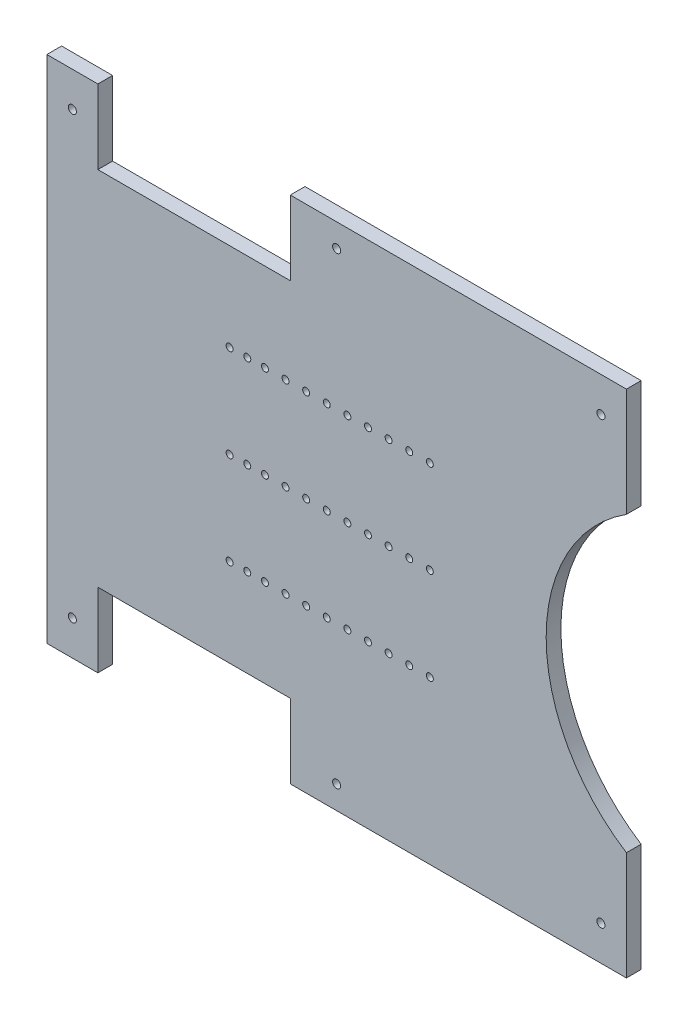
from build123d import *

# Parameters (mm, degrees)
SKETCH1_R           = 1.7525
SKETCH1_R_2         = 1.5
BOSS_EXTRUDE1_DEPTH = 6.35


with BuildPart() as part:
    # Sketch1 → Boss-Extrude1 (new body)
    with BuildSketch(Plane.XY):
        with BuildLine():
            Line((119.609790965, 110), (97.609790965, 110))
            Line((97.609790965, 110), (14.609790965, 110))
            Line((14.609790965, 110), (-25.390209035, 110))
            Line((-25.390209035, 110), (-25.390209035, 78))
            Line((-25.390209035, 78), (-108.390209035, 78))
            Line((-108.390209035, 78), (-108.390209035, 110))
            Line((-108.390209035, 110), (-130.390209035, 110))
            Line((-130.390209035, 110), (-130.390209035, -110))
            Line((-130.390209035, -110), (-108.390209035, -110))
            Line((-108.390209035, -110), (-108.390209035, -78))
            Line((-108.390209035, -78), (-25.390209035, -78))
            Line((-25.390209035, -78), (-25.390209035, -110))
            Line((-25.390209035, -110), (14.609790965, -110))
            Line((14.609790965, -110), (97.609790965, -110))
            Line((97.609790965, -110), (119.609790965, -110))
            Line((119.609790965, -110), (119.609790965, -63.2))
            ThreePointArc((119.609790965, -63.2), (84.992460515, 0), (119.609790965, 63.2))
            Line((119.609790965, 63.2), (119.609790965, 110))
        make_face()
        with Locations((-119.390209035, 95)):
            Circle(SKETCH1_R, mode=Mode.SUBTRACT)
        with Locations(Location((108.609790965, 95, 0), (0, 0, 180))):
            Circle(SKETCH1_R, mode=Mode.SUBTRACT)
        with Locations((-5.390209035, 100)):
            Circle(SKETCH1_R, mode=Mode.SUBTRACT)
        with Locations(Location((-5.390209035, -100, 0), (0, 0, 180))):
            Circle(SKETCH1_R, mode=Mode.SUBTRACT)
        with Locations((108.609790965, -95)):
            Circle(SKETCH1_R, mode=Mode.SUBTRACT)
        with Locations(Location((-119.390209035, -95, 0), (0, 0, 180))):
            Circle(SKETCH1_R, mode=Mode.SUBTRACT)
        with Locations((-36.311771099, 40)):
            Circle(SKETCH1_R_2, mode=Mode.SUBTRACT)
        with Locations((-36.311771099, 0)):
            Circle(SKETCH1_R_2, mode=Mode.SUBTRACT)
        with Locations(Location((-36.311771099, -40, 0), (0, 0, 180))):
            Circle(SKETCH1_R_2, mode=Mode.SUBTRACT)
        with Locations(Location((-27.421771099, -40, 0), (0, 0, 180))):
            Circle(SKETCH1_R_2, mode=Mode.SUBTRACT)
        with Locations((-27.421771099, 0)):
            Circle(SKETCH1_R_2, mode=Mode.SUBTRACT)
        with Locations((-27.421771099, 40)):
            Circle(SKETCH1_R_2, mode=Mode.SUBTRACT)
        with Locations(Location((-18.531771099, -40, 0), (0, 0, 180))):
            Circle(SKETCH1_R_2, mode=Mode.SUBTRACT)
        with Locations((-18.531771099, 0)):
            Circle(SKETCH1_R_2, mode=Mode.SUBTRACT)
        with Locations((-18.531771099, 40)):
            Circle(SKETCH1_R_2, mode=Mode.SUBTRACT)
        with Locations(Location((-9.641771099, -40, 0), (0, 0, 180))):
            Circle(SKETCH1_R_2, mode=Mode.SUBTRACT)
        with Locations((-9.641771099, 0)):
            Circle(SKETCH1_R_2, mode=Mode.SUBTRACT)
        with Locations((-9.641771099, 40)):
            Circle(SKETCH1_R_2, mode=Mode.SUBTRACT)
        with Locations(Location((-0.751771099, -40, 0), (0, 0, 180))):
            Circle(SKETCH1_R_2, mode=Mode.SUBTRACT)
        with Locations((-0.751771099, 0)):
            Circle(SKETCH1_R_2, mode=Mode.SUBTRACT)
        with Locations((-0.751771099, 40)):
            Circle(SKETCH1_R_2, mode=Mode.SUBTRACT)
        with Locations(Location((8.138228901, -40, 0), (0, 0, 180))):
            Circle(SKETCH1_R_2, mode=Mode.SUBTRACT)
        with Locations((8.138228901, 0)):
            Circle(SKETCH1_R_2, mode=Mode.SUBTRACT)
        with Locations((8.138228901, 40)):
            Circle(SKETCH1_R_2, mode=Mode.SUBTRACT)
        with Locations(Location((17.028228901, -40, 0), (0, 0, 180))):
            Circle(SKETCH1_R_2, mode=Mode.SUBTRACT)
        with Locations((17.028228901, 0)):
            Circle(SKETCH1_R_2, mode=Mode.SUBTRACT)
        with Locations((17.028228901, 40)):
            Circle(SKETCH1_R_2, mode=Mode.SUBTRACT)
        with Locations(Location((25.918228901, -40, 0), (0, 0, 180))):
            Circle(SKETCH1_R_2, mode=Mode.SUBTRACT)
        with Locations((25.918228901, 0)):
            Circle(SKETCH1_R_2, mode=Mode.SUBTRACT)
        with Locations((25.918228901, 40)):
            Circle(SKETCH1_R_2, mode=Mode.SUBTRACT)
        with Locations(Location((34.808228901, -40, 0), (0, 0, 180))):
            Circle(SKETCH1_R_2, mode=Mode.SUBTRACT)
        with Locations((34.808228901, 0)):
            Circle(SKETCH1_R_2, mode=Mode.SUBTRACT)
        with Locations((34.808228901, 40)):
            Circle(SKETCH1_R_2, mode=Mode.SUBTRACT)
        with Locations((-43.931771099, 0)):
            Circle(SKETCH1_R_2, mode=Mode.SUBTRACT)
        with Locations(Location((-43.931771099, -40, 0), (0, 0, 180))):
            Circle(SKETCH1_R_2, mode=Mode.SUBTRACT)
        with Locations((-43.931771099, 40)):
            Circle(SKETCH1_R_2, mode=Mode.SUBTRACT)
        with Locations((-51.551771099, 0)):
            Circle(SKETCH1_R_2, mode=Mode.SUBTRACT)
        with Locations(Location((-51.551771099, -40, 0), (0, 0, 180))):
            Circle(SKETCH1_R_2, mode=Mode.SUBTRACT)
        with Locations((-51.551771099, 40)):
            Circle(SKETCH1_R_2, mode=Mode.SUBTRACT)
    extrude(amount=BOSS_EXTRUDE1_DEPTH)


solid = part.part
